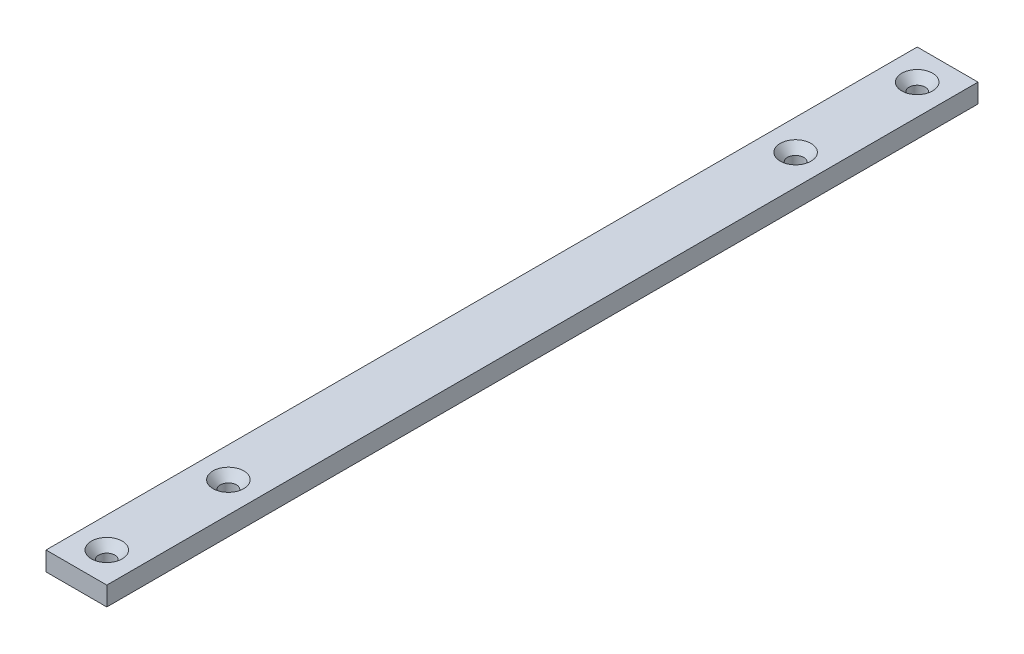
from build123d import *

# Parameters (mm, degrees)
SKETCH3_W                                        = 25.4
SKETCH3_H                                        = 7.9375
BOSS_EXTRUDE1_DEPTH                              = 182
CSK_FOR_1_4_FLAT_HEAD_MACHINE_SCREW1_D           = 6.7564
CSK_FOR_1_4_FLAT_HEAD_MACHINE_SCREW1_CSINK_D     = 12.8778
CSK_FOR_1_4_FLAT_HEAD_MACHINE_SCREW1_CSINK_ANGLE = 82


with BuildPart() as part:
    # Sketch3 → Boss-Extrude1 (new, symmetric)
    with BuildSketch(Plane.XY):
        Rectangle(SKETCH3_W, SKETCH3_H)
    extrude(amount=BOSS_EXTRUDE1_DEPTH, both=True)

    # CSK for 1/4 Flat Head Machine Screw1 (through all)
    with Locations(Plane(origin=(0, 3.96875, 0), x_dir=(1, 0, 0), z_dir=(0, 1, 0))):
        with Locations((0, 169.3), (0, -169.3), (0, 118.5), (0, -118.5)):
            CounterSinkHole(CSK_FOR_1_4_FLAT_HEAD_MACHINE_SCREW1_D / 2, CSK_FOR_1_4_FLAT_HEAD_MACHINE_SCREW1_CSINK_D / 2, counter_sink_angle=CSK_FOR_1_4_FLAT_HEAD_MACHINE_SCREW1_CSINK_ANGLE)


solid = part.part
